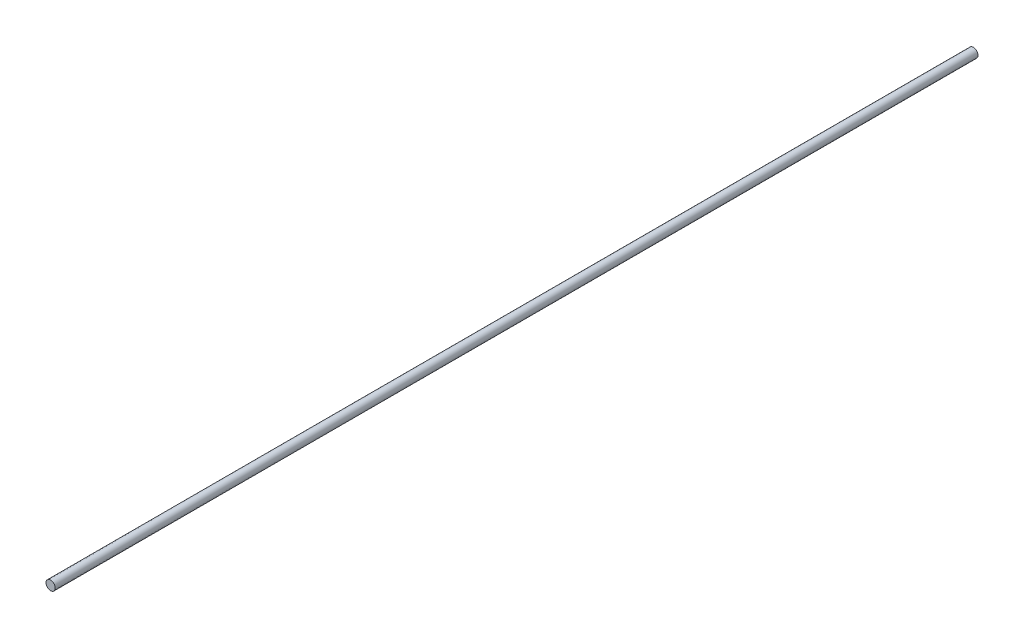
from build123d import *

# Parameters (mm, degrees)
SKETCH1_R           = 4
BOSS_EXTRUDE1_DEPTH = 800


with BuildPart() as part:
    # Sketch1 → Boss-Extrude1 (new body)
    with BuildSketch(Plane.XY):
        Circle(SKETCH1_R)
    extrude(amount=BOSS_EXTRUDE1_DEPTH)


solid = part.part
